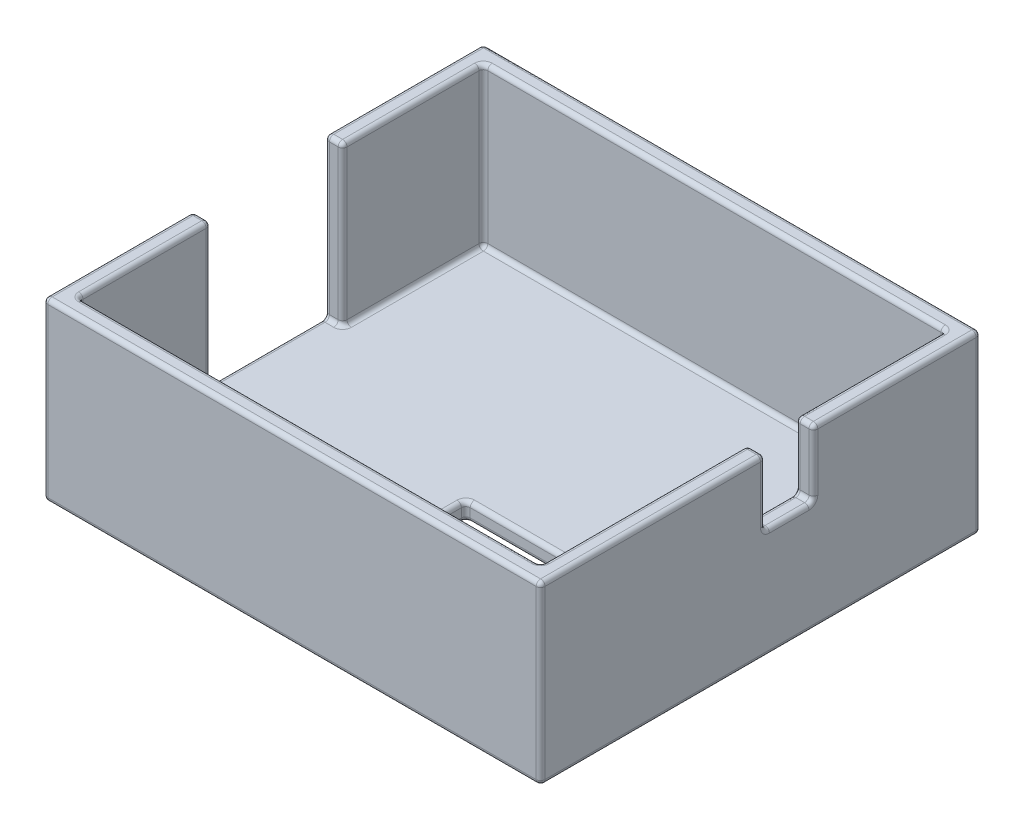
from build123d import *

# Parameters (mm, degrees)
SKETCH1_W           = 113
SKETCH1_H           = 100
BOSS_EXTRUDE1_DEPTH = 4
SKETCH2_W           = 113
SKETCH2_H           = 100
SKETCH2_W_2         = 105
SKETCH2_H_2         = 92
BOSS_EXTRUDE2_DEPTH = 36
SKETCH3_W           = 30
SKETCH3_H           = 36
CUT_EXTRUDE1_DEPTH  = 40
SKETCH4_W           = 11
SKETCH4_H           = 15
CUT_EXTRUDE2_DEPTH  = 40
SKETCH5_W           = 43
SKETCH5_H           = 31
CUT_EXTRUDE3_DEPTH  = 40
FILLET1_R           = 1


with BuildPart() as part:
    # Sketch1 → Boss-Extrude1 (new body)
    with BuildSketch(Plane(origin=(0, 0, 0), x_dir=(1, 0, 0), z_dir=(0, 1, 0))):
        with Locations((56.5, 50)):
            Rectangle(SKETCH1_W, SKETCH1_H)
    extrude(amount=BOSS_EXTRUDE1_DEPTH)

    # Sketch2 → Boss-Extrude2 (add)
    with BuildSketch(Plane(origin=(0, 4, 0), x_dir=(1, 0, 0), z_dir=(0, 1, 0))):
        with Locations((56.5, 50)):
            Rectangle(SKETCH2_W, SKETCH2_H)
        with Locations((56.5, 50)):
            Rectangle(SKETCH2_W_2, SKETCH2_H_2, mode=Mode.SUBTRACT)
    extrude(amount=BOSS_EXTRUDE2_DEPTH)

    # Sketch3 → Cut-Extrude1 (cut)
    with BuildSketch(Plane(origin=(4, 0, 0), x_dir=(0, 0, -1), z_dir=(1, 0, 0))):
        with Locations((49, 22)):
            Rectangle(SKETCH3_W, SKETCH3_H)
    extrude(amount=-CUT_EXTRUDE1_DEPTH, mode=Mode.SUBTRACT)

    # Sketch4 → Cut-Extrude2 (cut)
    with BuildSketch(Plane.ZY.offset(-109)):
        with Locations((-56.5, 32.5)):
            Rectangle(SKETCH4_W, SKETCH4_H)
    extrude(amount=-CUT_EXTRUDE2_DEPTH, mode=Mode.SUBTRACT)

    # Sketch5 → Cut-Extrude3 (cut)
    with BuildSketch(Plane.XZ):
        with Locations((73.5, -28.5)):
            Rectangle(SKETCH5_W, SKETCH5_H)
    extrude(amount=-CUT_EXTRUDE3_DEPTH, mode=Mode.SUBTRACT)

    # Fillet1
    fillet1_edges = [part.edges().sort_by_distance(p)[0] for p in [
        (0, 40, -82),
        (56.5, 40, 0),
        (113, 40, -25.5),
        (56.5, 40, -100),
        (4, 4, -80),
        (56.5, 4, -4),
        (109, 4, -50),
        (56.5, 4, -96),
        (4, 40, -80),
        (4, 22, -4),
        (56.5, 40, -4),
        (109, 22, -4),
        (109, 40, -27.5),
        (109, 22, -96),
        (56.5, 40, -96),
        (4, 22, -96),
        (4, 4, -19),
        (4, 40, -19),
        (0, 40, -17),
        (2, 40, -34),
        (0, 22, -64),
        (2, 40, -64),
        (0, 4, -49),
        (2, 4, -64),
        (0, 22, -34),
        (2, 4, -34),
        (4, 22, -34),
        (4, 22, -64),
        (56.5, 0, -100),
        (113, 0, -50),
        (56.5, 0, 0),
        (109, 40, -79),
        (113, 40, -81),
        (0, 0, -50),
        (113, 32.5, -62),
        (111, 25, -62),
        (111, 40, -62),
        (113, 32.5, -51),
        (111, 40, -51),
        (113, 25, -56.5),
        (111, 25, -51),
        (109, 32.5, -62),
        (109, 25, -56.5),
        (109, 32.5, -51),
        (73.5, 4, -44),
        (0, 20, -100),
        (95, 4, -28.5),
        (73.5, 4, -13),
        (52, 4, -28.5),
        (113, 20, -100),
        (113, 20, 0),
        (0, 20, 0),
        (52, 2, -44),
        (52, 2, -13),
        (95, 2, -13),
        (95, 2, -44),
        (52, 0, -28.5),
        (73.5, 0, -44),
        (95, 0, -28.5),
        (73.5, 0, -13),
    ]]
    fillet(fillet1_edges, radius=FILLET1_R)


solid = part.part
